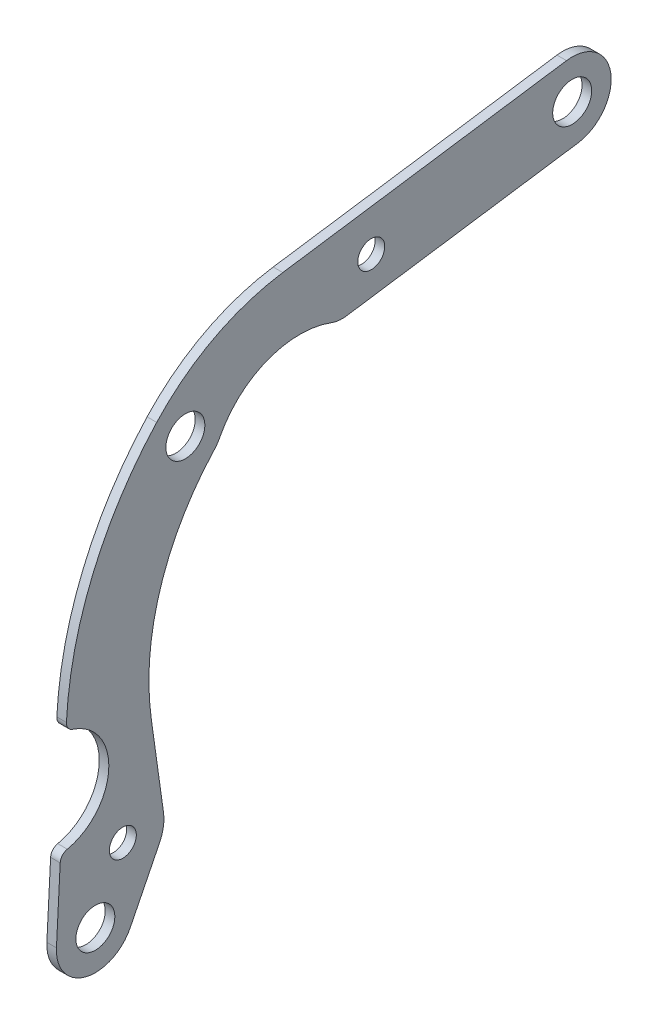
from build123d import *

# Parameters (mm, degrees)
EXTRUDE1_DEPTH            = 3.2
SKETCH5_R                 = 6.5
CHASSIS_MOUNT_HOLES_DEPTH = 244.405812041
SKETCH6_R                 = 4.5
ENGINE_MOUNT_HOLES_DEPTH  = 244.405812041


with BuildPart() as part:
    # Sketch4 → Extrude1 (new body)
    with BuildSketch(Plane(origin=(0, 0, 0), x_dir=(0, 0, -1), z_dir=(1, 0, 0))):
        with BuildLine():
            Line((62.532051611, 158.051475499), (157.209419868, 171.960961445))
            ThreePointArc((157.209419868, 171.960961445), (171.960961445, 160.988631666), (160.988631666, 146.237090089))
            Line((160.988631666, 146.237090089), (83.804641545, 134.897636473))
            ThreePointArc((83.804641545, 134.897636473), (81.285036333, 134.84841996), (78.833134949, 135.430667579))
            ThreePointArc((78.833134949, 135.430667579), (57.476451891, 135.335862335), (41.594586736, 121.057092835))
            ThreePointArc((41.594586736, 121.057092835), (40.693699631, 119.560345202), (39.600266647, 118.197900576))
            ThreePointArc((39.600266647, 118.197900576), (21.5857968, 86.934366989), (18.660417288, 50.97088814))
            Line((18.660417288, 50.97088814), (22.745312053, 21.905351613))
            ThreePointArc((22.745312053, 21.905351613), (22.700845783, 17.796400072), (21.440584589, 13.88523634))
            Line((21.440584589, 13.88523634), (11.636162946, -5.796526027))
            ThreePointArc((11.636162946, -5.796526027), (-3.307639706, -12.572172512), (-12.982184032, 0.680367435))
            Line((-12.982184032, 0.680367435), (-11.728287792, 24.606132992))
            ThreePointArc((-11.728287792, 24.606132992), (-11.013879957, 26.397161442), (-9.356926136, 27.383399496))
            ThreePointArc((-9.356926136, 27.383399496), (4.476016858, 43.584120766), (-7.587711328, 61.142029063))
            ThreePointArc((-7.587711328, 61.142029063), (-9.132498235, 62.296063238), (-9.655779017, 64.1519562))
            ThreePointArc((-9.655779017, 64.1519562), (-0.849075896, 102.602883239), (20.462203873, 135.797177398))
            ThreePointArc((20.462203873, 135.797177398), (39.583099322, 150.54263352), (62.532051611, 158.051475499))
        make_face()
    extrude(amount=EXTRUDE1_DEPTH)

    # Sketch5 → chassis mount holes (cut, through all)
    with BuildSketch(Plane(origin=(0, 0, 0), x_dir=(0, 0, -1), z_dir=(1, 0, 0))):
        Circle(SKETCH5_R)
        with Locations((159.099025767, 159.099025767)):
            Circle(SKETCH5_R)
        with Locations((30.03123526, 126.997538987)):
            Circle(SKETCH5_R)
    extrude(amount=CHASSIS_MOUNT_HOLES_DEPTH, mode=Mode.SUBTRACT)

    # Sketch6 → engine mount holes (cut, through all)
    with BuildSketch(Plane(origin=(0, 0, 0), x_dir=(0, 0, -1), z_dir=(1, 0, 0))):
        with Locations((9.170519858, 19.997538987)):
            Circle(SKETCH6_R)
        with Locations((92.049906905, 148.605498316)):
            Circle(SKETCH6_R)
    extrude(amount=ENGINE_MOUNT_HOLES_DEPTH, mode=Mode.SUBTRACT)


solid = part.part
